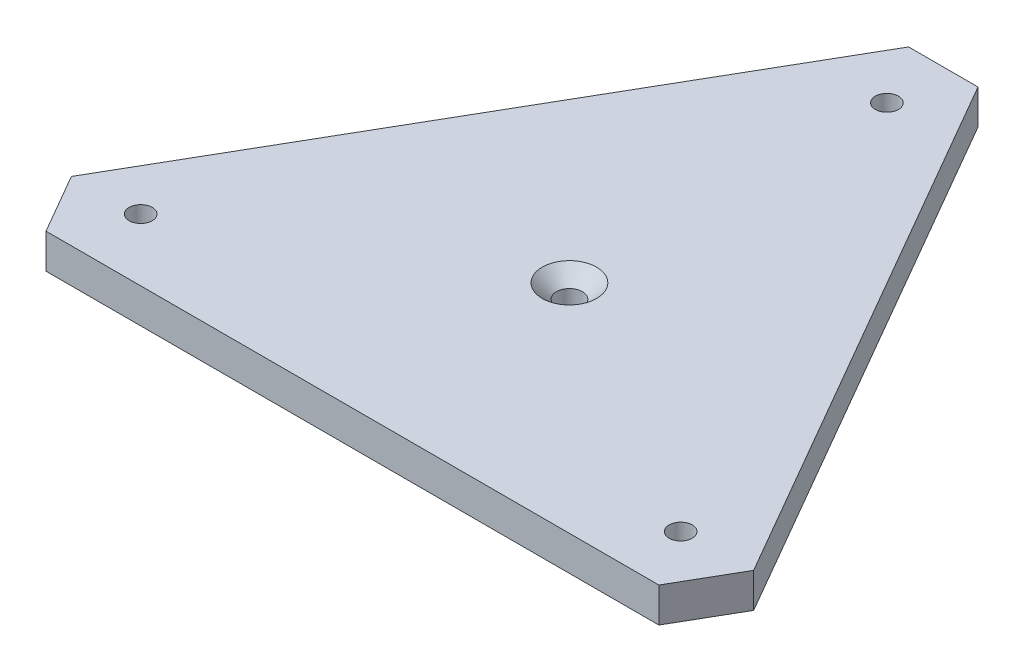
from build123d import *

# Parameters (mm, degrees)
BOSS_EXTRUDE1_DEPTH                             = 6
CSK_FOR_M4_FLAT_HEAD_MACHINE_SCREW1_D           = 4.5
CSK_FOR_M4_FLAT_HEAD_MACHINE_SCREW1_CSINK_D     = 9.4
CSK_FOR_M4_FLAT_HEAD_MACHINE_SCREW1_CSINK_ANGLE = 90
CUT_EXTRUDE1_DEPTH                              = 88.740146645
CUT_EXTRUDE1_DEPTH_BACK                         = 88.740146645
SKETCH3_R                                       = 2
CUT_EXTRUDE3_START                              = -3
CUT_EXTRUDE3_DEPTH                              = 10


with BuildPart() as part:
    # Sketch2 → Boss-Extrude1 (new body)
    with BuildSketch(Plane(origin=(0, 0, 0), x_dir=(1, 0, 0), z_dir=(0, 1, 0))):
        Polygon((-6, 64.663230149), (-59, -27.135462652), (-53, -37.527767497), (53, -37.527767497), (59, -27.135462652), (6, 64.663230149), align=None)
    extrude(amount=BOSS_EXTRUDE1_DEPTH)

    # CSK for M4 Flat Head Machine Screw1 (through all)
    with Locations(Plane(origin=(0, 6, 0), x_dir=(1, 0, 0), z_dir=(0, 1, 0))):
        with Locations((0, 0)):
            CounterSinkHole(CSK_FOR_M4_FLAT_HEAD_MACHINE_SCREW1_D / 2, CSK_FOR_M4_FLAT_HEAD_MACHINE_SCREW1_CSINK_D / 2, counter_sink_angle=CSK_FOR_M4_FLAT_HEAD_MACHINE_SCREW1_CSINK_ANGLE)

    # Sketch3 → Cut-Extrude1 (cut, two sides: drawn at the far end of the back side and taken through both)
    with BuildSketch(Plane(origin=(0, 6, 0), x_dir=(1, 0, 0), z_dir=(0, 1, 0)).offset(-CUT_EXTRUDE1_DEPTH_BACK)):
        with Locations(Location((-47.372740925, -26.780019623, 0), (0, 0, 270))):
            Circle(SKETCH3_R)
        with Locations(Location((0.494193155, 54.416006899, 0), (0, 0, 270))):
            Circle(SKETCH3_R)
        with Locations(Location((46.87854777, -27.635987277, 0), (0, 0, 270))):
            Circle(SKETCH3_R)
    extrude(amount=CUT_EXTRUDE1_DEPTH + CUT_EXTRUDE1_DEPTH_BACK, mode=Mode.SUBTRACT)

    # Sketch7 → Cut-Extrude3 (cut)
    with BuildSketch(Plane(origin=(0, 6, 0), x_dir=(1, 0, 0), z_dir=(0, 1, 0)).offset(CUT_EXTRUDE3_START)):
        Polygon((-43.775560598, -25.136509042), (-46.997472676, -22.843014787), (-50.594653003, -24.486525368), (-50.969921252, -28.423530203), (-47.748009174, -30.717024458), (-44.150828847, -29.073513878), align=None)
        Polygon((3.716105233, 52.122512644), (4.091373482, 56.05951748), (0.869461405, 58.353011735), (-2.727718922, 56.709501154), (-3.102987172, 52.772496319), (0.118924906, 50.479002064), align=None)
        Polygon((43.281367443, -29.279497857), (46.50327952, -31.572992112), (50.100459847, -29.929481531), (50.475728097, -25.992476696), (47.253816019, -23.698982441), (43.656635692, -25.342493022), align=None)
    extrude(amount=-CUT_EXTRUDE3_DEPTH, mode=Mode.SUBTRACT)


solid = part.part
